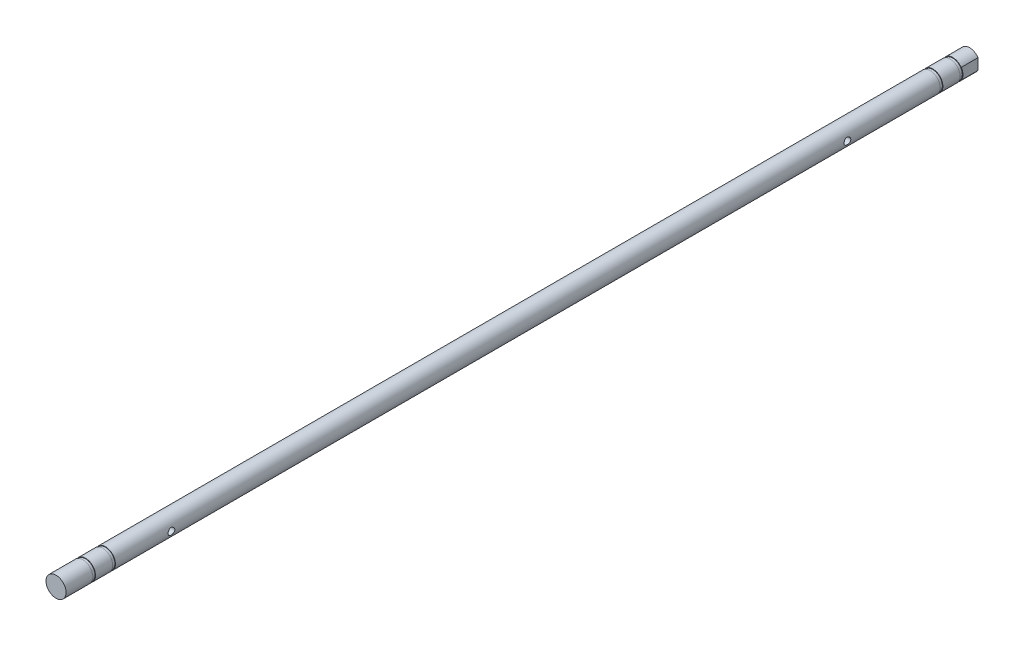
from build123d import *

# Parameters (mm, degrees)
SKETCH1_R                                 = 3
BOSS_EXTRUDE1_DEPTH                       = 275
SKETCH3_W                                 = 0.8
SKETCH3_H                                 = 0.5
CUT_EXTRUDE2_DEPTH                        = 276.032725326
CUT_EXTRUDE2_DEPTH_BACK                   = 276.032725326
SKETCH4_W                                 = 3.470061058
SKETCH4_H                                 = 7
SKETCH4_W_2                               = 2.92528695
CHAMFER1_SIZE                             = 0.3
RETAINING_GROOVES_D5P7_1_START            = 7.05
SKETCH5_R                                 = 2.85
SKETCH5_R_2                               = 2.49
RETAINING_GROOVES_D5P7_1_DEPTH            = 0.8
RETAINING_GROOVES_D5P7_2_START            = 13
SKETCH6_R                                 = 2.85
SKETCH6_R_2                               = 2.49
RETAINING_GROOVES_D5P7_2_DEPTH            = 0.8
RETAINING_GROOVES_D5P7_3_START            = 260.25
SKETCH7_R                                 = 2.85
SKETCH7_R_2                               = 2.49
RETAINING_GROOVES_D5P7_3_DEPTH            = 0.8
RETAINING_GROOVES_D5P7_4_START            = 266.2
SKETCH8_R                                 = 2.85
SKETCH8_R_2                               = 2.49
RETAINING_GROOVES_D5P7_4_DEPTH            = 0.8
TWO_HUB_CROSS_PIN_D2_DEPTH                = 276.032725326
TWO_HUB_CROSS_PIN_D2_DEPTH_BACK           = 276.032725326
SKETCH9_R                                 = 1
SKETCH10_R                                = 3.1
REVB_LOWER_SHAFT_NOSE_CLEARANCE_2MM_DEPTH = 2


with BuildPart() as part:
    # Sketch1 → Boss-Extrude1 (new body)
    with BuildSketch(Plane.XY):
        Circle(SKETCH1_R)
    extrude(amount=BOSS_EXTRUDE1_DEPTH)

    # Sketch3 → Cut-Revolve1 (revolve, cut)
    with BuildSketch(Plane(origin=(0, 0, 0), x_dir=(0, 0, -1), z_dir=(1, 0, 0)), mode=Mode.PRIVATE) as cut_revolve1_sk:
        with Locations((-266.6, 2.75)):
            Rectangle(SKETCH3_W, SKETCH3_H)
        with Locations((-260.65, 2.75)):
            Rectangle(SKETCH3_W, SKETCH3_H)
        with Locations((-13.4, 2.75)):
            Rectangle(SKETCH3_W, SKETCH3_H)
        with Locations((-7.45, 2.75)):
            Rectangle(SKETCH3_W, SKETCH3_H)
    revolve(cut_revolve1_sk.sketch.rotate(Axis((0, 0, 263.365004794), (0, 0, -1)), 90), axis=Axis((0, 0, 263.365004794), (0, 0, -1)), mode=Mode.SUBTRACT)

    # Sketch4 → Cut-Extrude2 (cut, two sides: drawn at the far end of the back side and taken through both)
    with BuildSketch(Plane(origin=(0, 0, 0), x_dir=(1, 0, 0), z_dir=(0, 1, 0)).offset(-CUT_EXTRUDE2_DEPTH_BACK)):
        with Locations((4.235030529, -3.5)):
            Rectangle(SKETCH4_W, SKETCH4_H)
        with Locations((-3.962643475, -3.5)):
            Rectangle(SKETCH4_W_2, SKETCH4_H)
    extrude(amount=CUT_EXTRUDE2_DEPTH + CUT_EXTRUDE2_DEPTH_BACK, mode=Mode.SUBTRACT)

    # Chamfer1
    chamfer1_edges = [part.edges().sort_by_distance(p)[0] for p in [
        (0, 3, 0),
        (0, -3, 0),
    ]]
    chamfer(chamfer1_edges, length=CHAMFER1_SIZE)

    # Sketch5 → Retaining_Grooves_D5p7_1 (add)
    with BuildSketch(Plane.XY.offset(RETAINING_GROOVES_D5P7_1_START)):
        Circle(SKETCH5_R)
        Circle(SKETCH5_R_2, mode=Mode.SUBTRACT)
    extrude(amount=RETAINING_GROOVES_D5P7_1_DEPTH)

    # Sketch6 → Retaining_Grooves_D5p7_2 (add)
    with BuildSketch(Plane.XY.offset(RETAINING_GROOVES_D5P7_2_START)):
        Circle(SKETCH6_R)
        Circle(SKETCH6_R_2, mode=Mode.SUBTRACT)
    extrude(amount=RETAINING_GROOVES_D5P7_2_DEPTH)

    # Sketch7 → Retaining_Grooves_D5p7_3 (add)
    with BuildSketch(Plane.XY.offset(RETAINING_GROOVES_D5P7_3_START)):
        Circle(SKETCH7_R)
        Circle(SKETCH7_R_2, mode=Mode.SUBTRACT)
    extrude(amount=RETAINING_GROOVES_D5P7_3_DEPTH)

    # Sketch8 → Retaining_Grooves_D5p7_4 (add)
    with BuildSketch(Plane.XY.offset(RETAINING_GROOVES_D5P7_4_START)):
        Circle(SKETCH8_R)
        Circle(SKETCH8_R_2, mode=Mode.SUBTRACT)
    extrude(amount=RETAINING_GROOVES_D5P7_4_DEPTH)

    # Sketch9 → Two_Hub_Cross_Pin_D2 (cut, two sides: drawn at the far end of the back side and taken through both)
    with BuildSketch(Plane(origin=(0, 0, 0), x_dir=(0, 0, -1), z_dir=(1, 0, 0)).offset(-TWO_HUB_CROSS_PIN_D2_DEPTH_BACK)):
        with Locations((-41.5, 0)):
            Circle(SKETCH9_R)
        with Locations((-243.5, 0)):
            Circle(SKETCH9_R)
    extrude(amount=TWO_HUB_CROSS_PIN_D2_DEPTH + TWO_HUB_CROSS_PIN_D2_DEPTH_BACK, mode=Mode.SUBTRACT)

    # Sketch10 → RevB_Lower_Shaft_Nose_Clearance_2mm (cut)
    with BuildSketch(Plane(origin=(0, 0, 0), x_dir=(-1, 0, 0), z_dir=(0, 0, -1))):
        Circle(SKETCH10_R)
    extrude(amount=-REVB_LOWER_SHAFT_NOSE_CLEARANCE_2MM_DEPTH, mode=Mode.SUBTRACT)


solid = part.part
